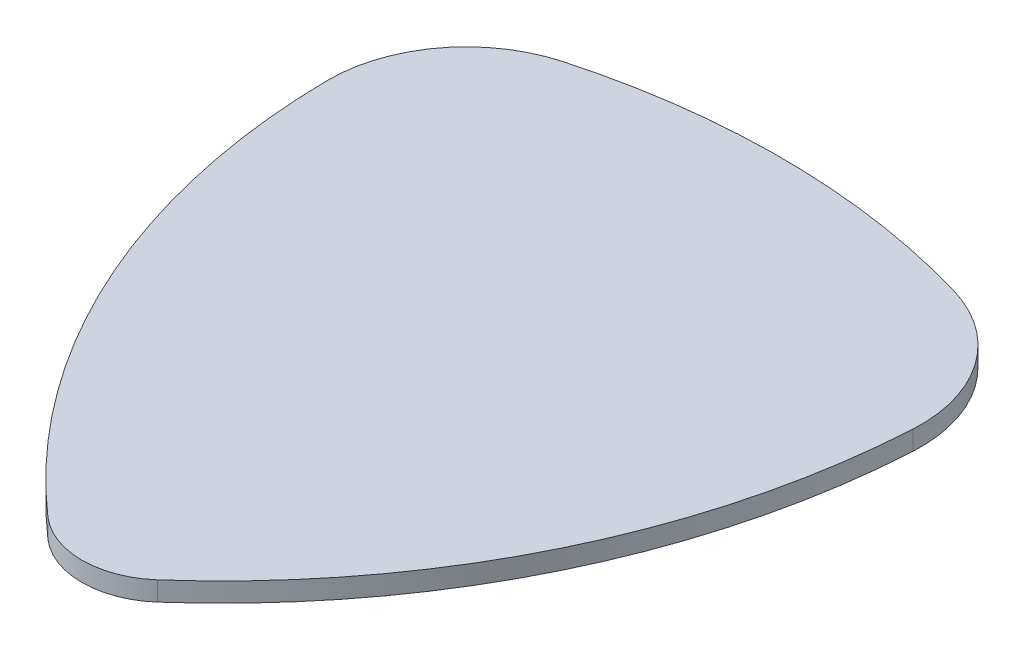
from build123d import *

# Parameters (mm, degrees)
BOSS_EXTRUDE1_DEPTH = 0.7
FILLET1_R           = 5
FILLET2_R           = 5
FILLET3_R           = 3
SCALE1_SCALE        = 1.2


with BuildPart() as part:
    # Sketch1 → Boss-Extrude1 (new body)
    with BuildSketch(Plane(origin=(0, 0, 0), x_dir=(1, 0, 0), z_dir=(0, 1, 0))):
        with BuildLine():
            ThreePointArc((0, 0), (10.674582486, 2.159113438), (21.303319094, -0.215426558))
            ThreePointArc((21.303319094, -0.215426558), (18.980175942, -13.538262848), (10.41005245, -24))
            ThreePointArc((10.41005245, -24), (1.872716321, -13.445396703), (0, 0))
        make_face()
    extrude(amount=BOSS_EXTRUDE1_DEPTH)

    # Fillet1
    fillet1_edges = [part.edges().sort_by_distance(p)[0] for p in [
        (21.303319094, 0.35, 0.215426558),
    ]]
    fillet(fillet1_edges, radius=FILLET1_R)

    # Fillet2
    fillet2_edges = [part.edges().sort_by_distance(p)[0] for p in [
        (0, 0.35, 0),
    ]]
    fillet(fillet2_edges, radius=FILLET2_R)

    # Fillet3
    fillet3_edges = [part.edges().sort_by_distance(p)[0] for p in [
        (10.41005245, 0.35, 24),
    ]]
    fillet(fillet3_edges, radius=FILLET3_R)


with BuildPart() as part_1:
    # Scale1: scaled about (10.489972613, 0.35, 8.803486941)
    add(part.part.scale(SCALE1_SCALE).moved(Location((-2.097994523, -0.07, -1.760697388))))


solid = part_1.part
